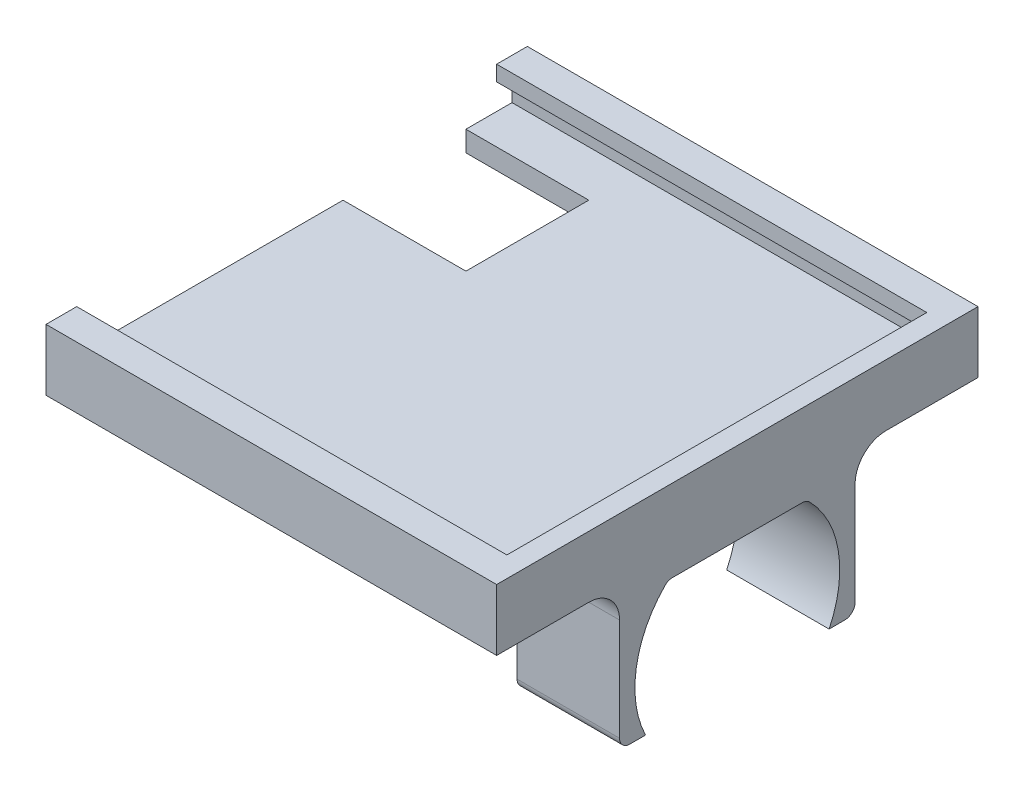
from build123d import *

# Parameters (mm, degrees)
SKETCH3_W           = 44
SKETCH3_H           = 47
BOSS_EXTRUDE1_DEPTH = 6
SKETCH4_W           = 42
SKETCH4_H           = 44
CUT_EXTRUDE1_DEPTH  = 4
SKETCH5_W           = 44
SKETCH5_H           = 3
BOSS_EXTRUDE2_DEPTH = 1.5
SKETCH6_W           = 24
SKETCH6_H           = 12
CUT_EXTRUDE2_DEPTH  = 2
BOSS_EXTRUDE3_START = 22
BOSS_EXTRUDE3_DEPTH = 10
FILLET1_R           = 3
FILLET2_R           = 1


with BuildPart() as part:
    # Sketch3 → Boss-Extrude1 (new body)
    with BuildSketch(Plane(origin=(0, 0, 0), x_dir=(1, 0, 0), z_dir=(0, 1, 0))):
        Rectangle(SKETCH3_W, SKETCH3_H)
    extrude(amount=BOSS_EXTRUDE1_DEPTH)

    # Sketch4 → Cut-Extrude1 (cut)
    with BuildSketch(Plane(origin=(0, 6, 0), x_dir=(1, 0, 0), z_dir=(0, 1, 0))):
        with Locations((-1, 0)):
            Rectangle(SKETCH4_W, SKETCH4_H)
    extrude(amount=-CUT_EXTRUDE1_DEPTH, mode=Mode.SUBTRACT)

    # Sketch5 → Boss-Extrude2 (add)
    with BuildSketch(Plane(origin=(0, 6, 0), x_dir=(1, 0, 0), z_dir=(0, 1, 0))):
        with Locations((0, 22)):
            Rectangle(SKETCH5_W, SKETCH5_H)
    boss_extrude2 = extrude(amount=-BOSS_EXTRUDE2_DEPTH)

    # Mirror1: Boss-Extrude2 across plane
    add(boss_extrude2.mirror(Plane.XY))

    # Sketch6 → Cut-Extrude2 (cut)
    with BuildSketch(Plane.XZ):
        with Locations((-22, -11.5)):
            Rectangle(SKETCH6_W, SKETCH6_H)
    extrude(amount=-CUT_EXTRUDE2_DEPTH, mode=Mode.SUBTRACT)

    # Sketch7 → Boss-Extrude3 (add)
    with BuildSketch(Plane(origin=(0, 0, 0), x_dir=(0, 0, -1), z_dir=(1, 0, 0)).offset(BOSS_EXTRUDE3_START)):
        with BuildLine():
            Line((-6.75, -2), (6.75, -2))
            ThreePointArc((6.75, -2), (9.829603655, -7.636154321), (8.962619003, -14))
            Line((8.962619003, -14), (11.5, -14))
            Line((11.5, -14), (11.5, 0))
            Line((11.5, 0), (-11.5, 0))
            Line((-11.5, 0), (-11.5, -14))
            Line((-11.5, -14), (-8.962619003, -14))
            ThreePointArc((-8.962619003, -14), (-9.829603655, -7.636154321), (-6.75, -2))
        make_face()
    extrude(amount=-BOSS_EXTRUDE3_DEPTH)

    # Fillet1
    fillet1_edges = [part.edges().sort_by_distance(p)[0] for p in [
        (17, 0, 11.5),
        (17, 0, -11.5),
    ]]
    fillet(fillet1_edges, radius=FILLET1_R)

    # Fillet2
    fillet2_edges = [part.edges().sort_by_distance(p)[0] for p in [
        (17, -2, 6.75),
        (17, -14, 11.5),
        (17, -14, -11.5),
        (17, -2, -6.75),
    ]]
    fillet(fillet2_edges, radius=FILLET2_R)


solid = part.part
